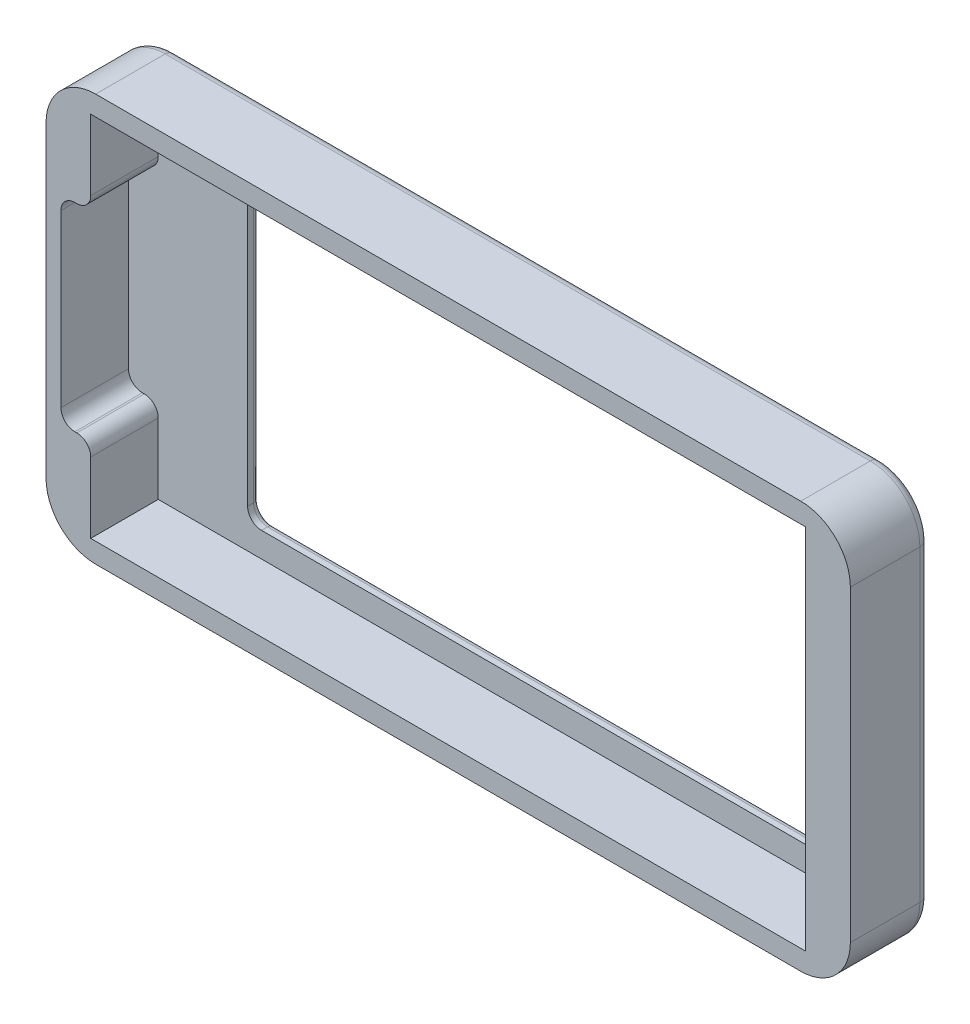
from build123d import *

# Parameters (mm, degrees)
SKETCH1_W           = 81
SKETCH1_H           = 41
BOSS_EXTRUDE1_DEPTH = 8
SKETCH2_W           = 72
SKETCH2_H           = 37
CUT_EXTRUDE1_DEPTH  = 6.8
SKETCH3_W           = 3
SKETCH3_H           = 20
CUT_EXTRUDE2_DEPTH  = 6.8
SKETCH4_W           = 60.6
SKETCH4_H           = 32
CUT_EXTRUDE3_DEPTH  = 6.4
FILLET1_R           = 1.4
FILLET2_R           = 5
FILLET3_R           = 0.6
FILLET4_R           = 1


with BuildPart() as part:
    # Sketch1 → Boss-Extrude1 (new body)
    with BuildSketch(Plane.XY):
        with Locations((40.5, 20.5)):
            Rectangle(SKETCH1_W, SKETCH1_H)
    extrude(amount=BOSS_EXTRUDE1_DEPTH)

    # Sketch2 → Cut-Extrude1 (cut)
    with BuildSketch(Plane.XY.offset(8)):
        with Locations((40.5, 20.5)):
            Rectangle(SKETCH2_W, SKETCH2_H)
    extrude(amount=-CUT_EXTRUDE1_DEPTH, mode=Mode.SUBTRACT)

    # Sketch3 → Cut-Extrude2 (cut)
    with BuildSketch(Plane.XY.offset(8)):
        with Locations((3, 20.5)):
            Rectangle(SKETCH3_W, SKETCH3_H)
    extrude(amount=-CUT_EXTRUDE2_DEPTH, mode=Mode.SUBTRACT)

    # Sketch4 → Cut-Extrude3 (cut)
    with BuildSketch(Plane.XY.offset(1.2)):
        with Locations((43.8, 20.5)):
            Rectangle(SKETCH4_W, SKETCH4_H)
    extrude(amount=-CUT_EXTRUDE3_DEPTH, mode=Mode.SUBTRACT)

    # Fillet1
    fillet1_edges = [part.edges().sort_by_distance(p)[0] for p in [
        (4.5, 30.5, 4.6),
        (4.5, 10.5, 4.6),
        (1.5, 10.5, 4.6),
        (1.5, 30.5, 4.6),
        (13.5, 4.5, 0.6),
        (13.5, 36.5, 0.6),
        (74.1, 36.5, 0.6),
        (74.1, 4.5, 0.6),
    ]]
    fillet(fillet1_edges, radius=FILLET1_R)

    # Fillet2
    fillet2_edges = [part.edges().sort_by_distance(p)[0] for p in [
        (0, 41, 4),
        (81, 41, 4),
        (81, 0, 4),
        (0, 0, 4),
    ]]
    fillet(fillet2_edges, radius=FILLET2_R)

    # Fillet3
    fillet3_edges = [part.edges().sort_by_distance(p)[0] for p in [
        (74.1, 20.5, 0),
        (43.8, 4.5, 0),
        (13.5, 20.5, 0),
        (43.8, 36.5, 0),
        (73.689949494, 4.910050506, 0),
        (13.910050506, 4.910050506, 0),
        (13.910050506, 36.089949494, 0),
        (73.689949494, 36.089949494, 0),
    ]]
    fillet(fillet3_edges, radius=FILLET3_R)

    # Fillet4
    fillet4_edges = [part.edges().sort_by_distance(p)[0] for p in [
        (40.5, 0, 0),
        (0, 20.5, 0),
        (40.5, 41, 0),
        (81, 20.5, 0),
        (1.464466094, 39.535533906, 0),
        (79.535533906, 39.535533906, 0),
        (79.535533906, 1.464466094, 0),
        (1.464466094, 1.464466094, 0),
    ]]
    fillet(fillet4_edges, radius=FILLET4_R)


solid = part.part
